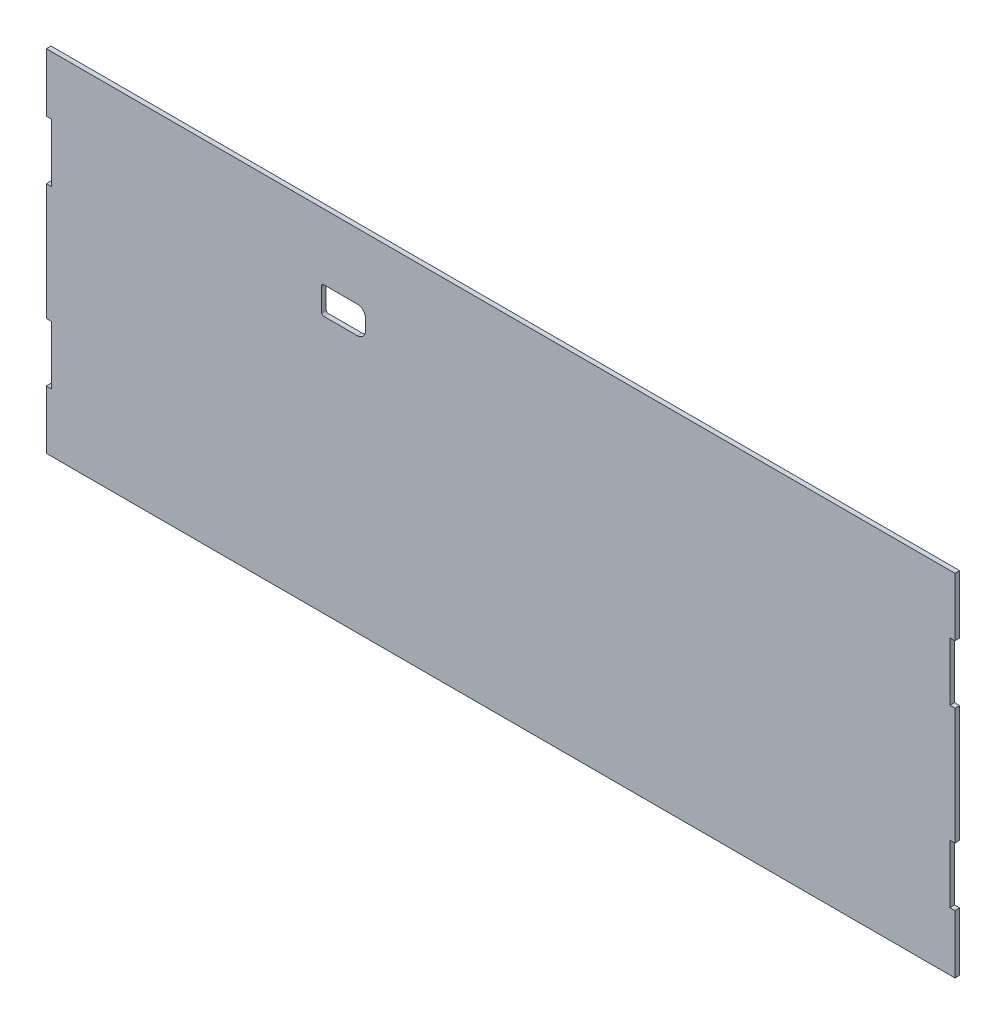
from build123d import *

# Parameters (mm, degrees)
SKETCH1_W           = 388.9
SKETCH1_H           = 150
BOSS_EXTRUDE1_DEPTH = 2
CUT_EXTRUDE1_DEPTH  = 2
CUT_EXTRUDE2_DEPTH  = 10


with BuildPart() as part:
    # Sketch1 → Boss-Extrude1 (new body)
    with BuildSketch(Plane.XY):
        Rectangle(SKETCH1_W, SKETCH1_H)
    extrude(amount=BOSS_EXTRUDE1_DEPTH)

    # Sketch2 → Cut-Extrude1 (cut)
    with BuildSketch(Plane.XY.offset(2)):
        Polygon((-194.45, 75), (-194.45, 50), (-192.25, 50), (-192.25, 25), (-194.45, 25), (-194.45, -25), (-192.25, -25), (-192.25, -50), (-194.45, -50), (-194.45, -75), (-200.131659393, -75), (-200.131659393, 75), align=None)
        Polygon((194.45, -75), (194.45, -50), (192.25, -50), (192.25, -25), (194.45, -25), (194.45, 25), (192.25, 25), (192.25, 50), (194.45, 50), (194.45, 75), (200.131659393, 75), (200.131659393, -75), align=None)
    extrude(amount=-CUT_EXTRUDE1_DEPTH, mode=Mode.SUBTRACT)

    # Sketch3 → Cut-Extrude2 (cut)
    with BuildSketch(Plane.XY.offset(2)):
        with BuildLine():
            Line((-61.37897888, 35.182338168), (-75.65397888, 35.182338168))
            ThreePointArc((-75.65397888, 35.182338168), (-76.361085661, 35.475231386), (-76.65397888, 36.182338168))
            Line((-76.65397888, 36.182338168), (-76.65397888, 45.882338168))
            ThreePointArc((-76.65397888, 45.882338168), (-76.361085661, 46.589444949), (-75.65397888, 46.882338168))
            Line((-75.65397888, 46.882338168), (-61.37897888, 46.882338168))
            ThreePointArc((-61.37897888, 46.882338168), (-58.886427476, 45.849889571), (-57.85397888, 43.357338168))
            Line((-57.85397888, 43.357338168), (-57.85397888, 38.707338168))
            ThreePointArc((-57.85397888, 38.707338168), (-58.886427476, 36.214786764), (-61.37897888, 35.182338168))
        make_face()
    extrude(amount=-CUT_EXTRUDE2_DEPTH, mode=Mode.SUBTRACT)


solid = part.part
